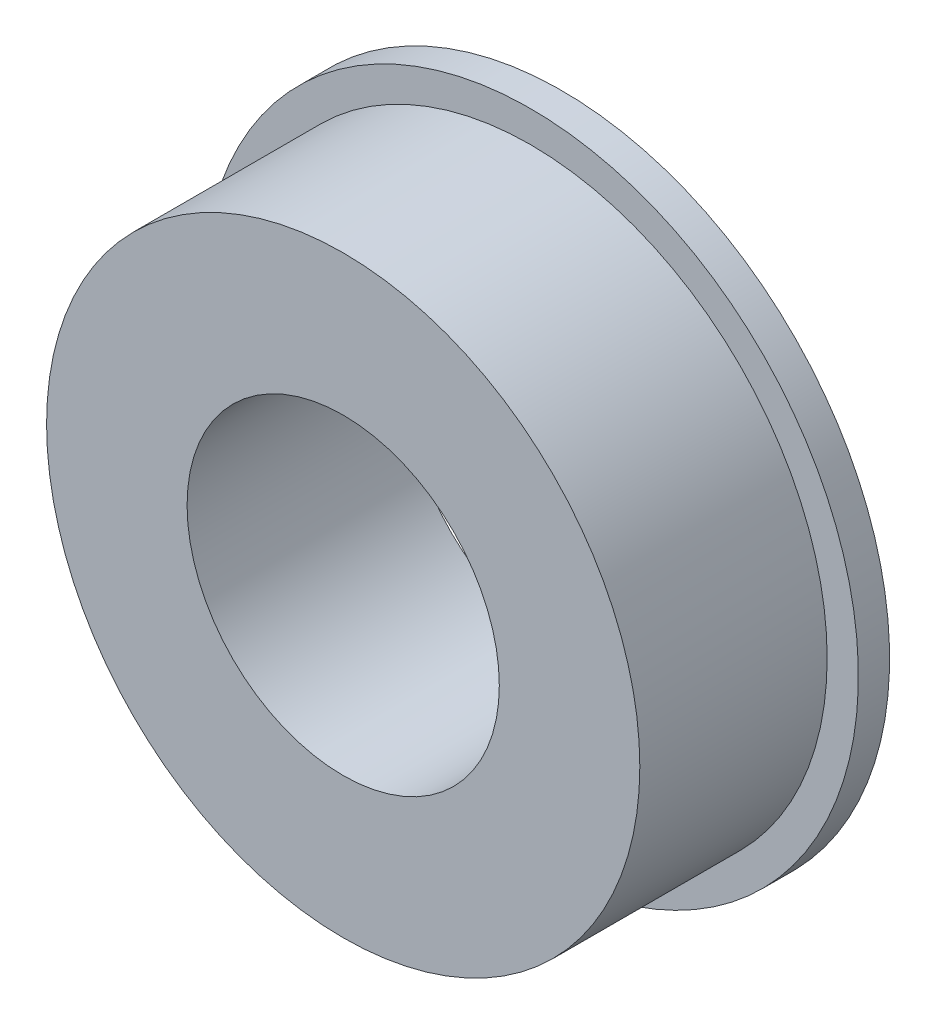
from build123d import *
from build123d.topology import SkipClean

# Parameters (mm, degrees)
SKETCH_1_R      = 9.5
SKETCH_1_R_2    = 5
EXTRUDE_1_DEPTH = 6
EXTRUDE_START   = 1
SKETCH_2_R      = 10.5
SKETCH_2_R_2    = 5
EXTRUDE_2_DEPTH = 1


with BuildPart() as part:
    # 草图1 → 凸台-拉伸1 (new body)
    with BuildSketch(Plane.XY):
        Circle(SKETCH_1_R)
        Circle(SKETCH_1_R_2, mode=Mode.SUBTRACT)
    extrude(amount=EXTRUDE_1_DEPTH)

    # 草图2 → 凸台-拉伸2 (add)
    with SkipClean():  # the faces are left unmerged after this step: merging them gives an invalid solid
        with BuildSketch(Plane(origin=(0, 0, 0), x_dir=(-1, 0, 0), z_dir=(0, 0, -1)).offset(EXTRUDE_START)):
            Circle(SKETCH_2_R)
            Circle(SKETCH_2_R_2, mode=Mode.SUBTRACT)
        extrude(amount=-EXTRUDE_2_DEPTH)


solid = part.part
